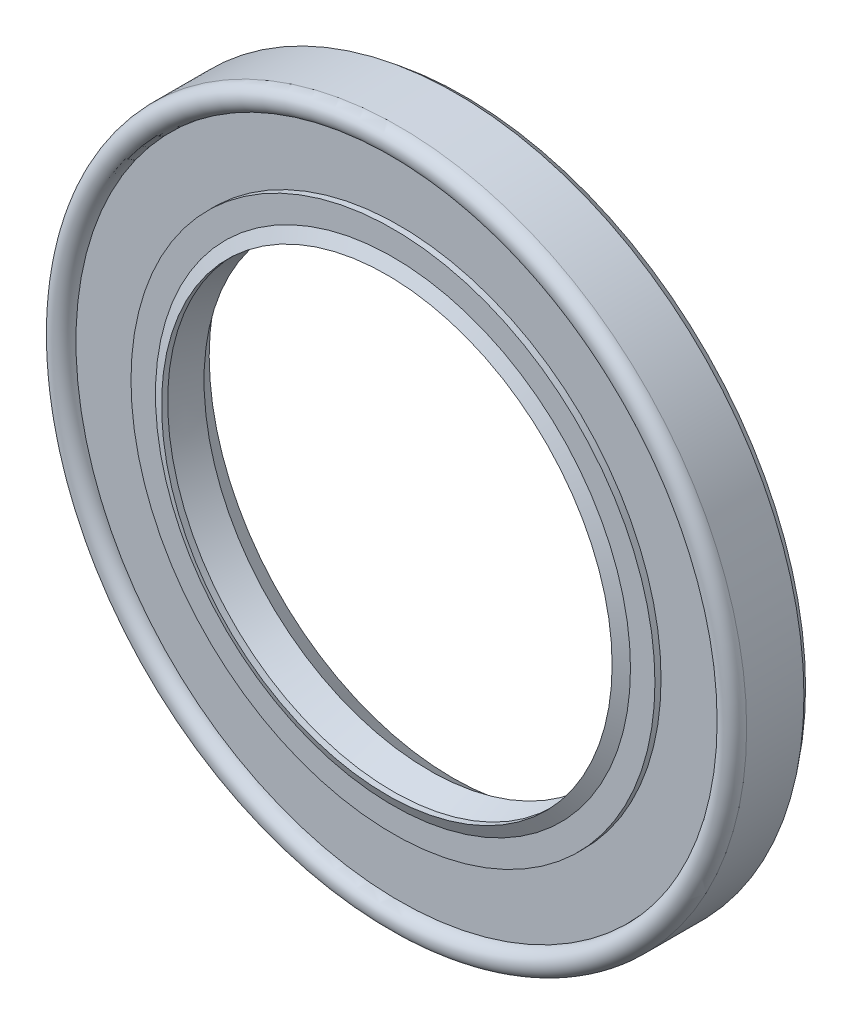
from build123d import *

# Parameters (mm, degrees)
SKETCH2_R = 0.95


with BuildPart() as part:
    # Sketch1 → Revolve1 (revolve)
    with BuildSketch(Plane(origin=(0, 0, 0), x_dir=(0, 0, -1), z_dir=(1, 0, 0)), mode=Mode.PRIVATE) as revolve1_sk:
        with BuildLine():
            Line((-3.175, 17.5), (-2.7, 17.5))
            Line((-2.7, 17.5), (-2.225, 18.45))
            Line((-2.225, 18.45), (0.125, 17.5))
            Line((0.125, 17.5), (1.95, 18.925))
            Line((1.95, 18.925), (1.95, 19.4))
            Line((1.95, 19.4), (1.075, 19.4))
            ThreePointArc((1.075, 19.4), (0.125, 18.45), (-0.825, 19.4))
            Line((-0.825, 19.4), (-1.275, 19.4))
            Line((-1.275, 19.4), (-1.275, 26.05))
            Line((-1.275, 26.05), (1.625, 26.05))
            Line((1.625, 26.05), (1.625, 26.2875))
            Line((1.625, 26.2875), (2.225, 26.2875))
            Line((2.225, 26.2875), (2.225, 26.05))
            Line((2.225, 26.05), (2.825, 26.05))
            Line((2.825, 26.05), (2.825, 26.525))
            Line((2.825, 26.525), (2.225, 27))
            Line((2.225, 27), (-2.225, 27))
            ThreePointArc((-2.225, 27), (-3.175, 26.05), (-2.225, 25.1))
            Line((-2.225, 25.1), (-2.225, 20.35))
            Line((-2.225, 20.35), (-2.7, 20.35))
            Line((-2.7, 20.35), (-2.7, 18.45))
            Line((-2.7, 18.45), (-3.175, 17.5))
        make_face()
    revolve(revolve1_sk.sketch.rotate(Axis((0, 0, -3.175), (0, 0, 1)), 270), axis=Axis((0, 0, -3.175), (0, 0, 1)))


with BuildPart() as body_2:
    # Sketch2 → Revolve2 (revolve)
    with BuildSketch(Plane(origin=(0, 0, 0), x_dir=(0, 0, -1), z_dir=(1, 0, 0)), mode=Mode.PRIVATE) as revolve2_sk:
        with Locations((0.125, 19.4)):
            Circle(SKETCH2_R)
    revolve(revolve2_sk.sketch.rotate(Axis((0, 0, 3.175), (0, 0, -1)), 180), axis=Axis((0, 0, 3.175), (0, 0, -1)))


solid = Compound([part.part, body_2.part])
